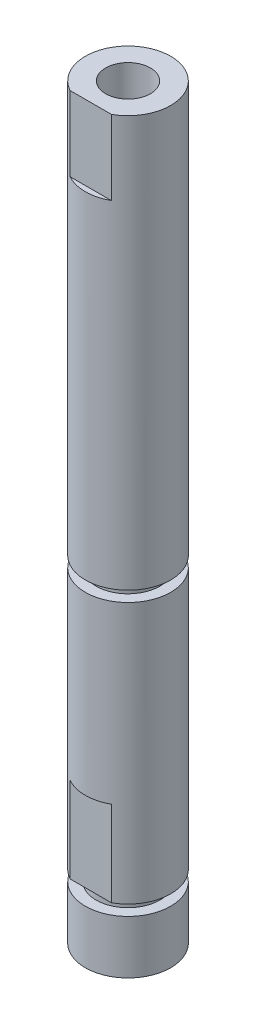
from build123d import *

# Parameters (mm, degrees)
CORTAR_EXTRUIR1_DEPTH         = 36.454195802
CORTAR_EXTRUIR1_DEPTH_BACK    = 36.454195802
CROQUIS2_W                    = 0.5
CROQUIS2_H                    = 8
CROQUIS2_H_2                  = 7
TALADRO_ROSCADO_M5X0_81_D     = 4.2
TALADRO_ROSCADO_M5X0_81_DEPTH = 8
TALADRO_ROSCADO_M5X0_81_TIP   = 1.2618073


with BuildPart() as part:
    # Croquis1 → Revolución1 (revolve)
    with BuildSketch(Plane.XY):
        Polygon((0, 35), (4, 35), (4, -3.52), (3, -3.52), (3, -4.52), (4, -4.52), (4, -29), (3, -29), (3, -30), (4, -30), (4, -35), (0, -35), align=None)
    revolve(axis=Axis((0, -35, 0), (0, 1, 0)))

    # Croquis2 → Cortar-Extruir1 (cut, two sides: drawn at the far end of the back side and taken through both)
    with BuildSketch(Plane(origin=(0, 0, 0), x_dir=(0, 0, -1), z_dir=(1, 0, 0)).offset(-CORTAR_EXTRUIR1_DEPTH_BACK)):
        with Locations((-3.75, -25)):
            Rectangle(CROQUIS2_W, CROQUIS2_H)
        with Locations((-3.75, 31.5)):
            Rectangle(CROQUIS2_W, CROQUIS2_H_2)
    extrude(amount=CORTAR_EXTRUIR1_DEPTH + CORTAR_EXTRUIR1_DEPTH_BACK, mode=Mode.SUBTRACT)

    # Taladro roscado M5x0.81
    with Locations(Plane(origin=(0, 35, 0), x_dir=(1, 0, 0), z_dir=(0, 1, 0))):
        with Locations((0, 0)):
            Hole(TALADRO_ROSCADO_M5X0_81_D / 2, depth=TALADRO_ROSCADO_M5X0_81_DEPTH)
            with Locations((0, 0, -(TALADRO_ROSCADO_M5X0_81_DEPTH + TALADRO_ROSCADO_M5X0_81_TIP / 2))):  # 118° drill point
                Cone(0, TALADRO_ROSCADO_M5X0_81_D / 2, TALADRO_ROSCADO_M5X0_81_TIP, mode=Mode.SUBTRACT)


solid = part.part
